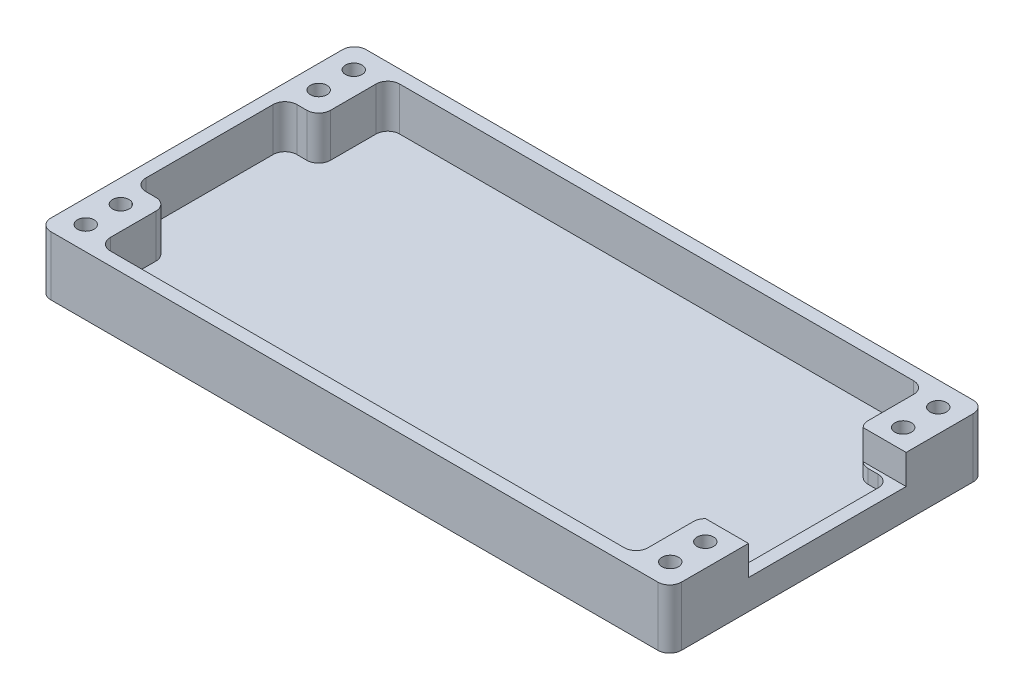
from build123d import *

# Parameters (mm, degrees)
EXTRUDE_1_DEPTH     = 15
CUT_EXTRUDE_1_DEPTH = 11
EXTRUDE_2_DEPTH     = 11
SKETCH_4_R          = 2.1
CUT_EXTRUDE_2_DEPTH = 91.691785736
FILLET_1_R          = 3
CUT_EXTRUDE_3_REACH = 167.605
SKETCH_5_W          = 40
SKETCH_5_H          = 40


with BuildPart() as part:
    # Эскиз1 → Бобышка-Вытянуть1 (new body)
    with BuildSketch(Plane(origin=(0, 0, 0), x_dir=(1, 0, 0), z_dir=(0, 1, 0))):
        with BuildLine():
            Line((-77, -40), (77, -40))
            ThreePointArc((77, -40), (79.121320344, -39.121320344), (80, -37))
            Line((80, -37), (80, 37))
            ThreePointArc((80, 37), (79.121320344, 39.121320344), (77, 40))
            Line((77, 40), (-77, 40))
            ThreePointArc((-77, 40), (-79.121320344, 39.121320344), (-80, 37))
            Line((-80, 37), (-80, -37))
            ThreePointArc((-80, -37), (-79.121320344, -39.121320344), (-77, -40))
        make_face()
    extrude(amount=EXTRUDE_1_DEPTH)

    # Эскиз2 → Вырез-Вытянуть1 (cut)
    with BuildSketch(Plane(origin=(0, 15, 0), x_dir=(1, 0, 0), z_dir=(0, 1, 0))):
        with BuildLine():
            Line((-75.75, -36.7), (75.75, -36.7))
            ThreePointArc((75.75, -36.7), (76.457106781, -36.407106781), (76.75, -35.7))
            Line((76.75, -35.7), (76.75, 35.7))
            ThreePointArc((76.75, 35.7), (76.457106781, 36.407106781), (75.75, 36.7))
            Line((75.75, 36.7), (-75.75, 36.7))
            ThreePointArc((-75.75, 36.7), (-76.457106781, 36.407106781), (-76.75, 35.7))
            Line((-76.75, 35.7), (-76.75, -35.7))
            ThreePointArc((-76.75, -35.7), (-76.457106781, -36.407106781), (-75.75, -36.7))
        make_face()
    extrude(amount=-CUT_EXTRUDE_1_DEPTH, mode=Mode.SUBTRACT)

    # Эскиз3 → Бобышка-Вытянуть2 (add)
    with BuildSketch(Plane(origin=(0, 4, 0), x_dir=(1, 0, 0), z_dir=(0, 1, 0))):
        with BuildLine():
            Line((-76.75, -36.7), (-68.2, -36.7))
            Line((-68.2, -36.7), (-68.2, -22.15))
            ThreePointArc((-68.2, -22.15), (-69.078679656, -20.028679656), (-71.2, -19.15))
            Line((-71.2, -19.15), (-76.75, -19.15))
            Line((-76.75, -19.15), (-76.75, -36.7))
        make_face()
        with BuildLine():
            Line((-68.2, 36.7), (-68.2, 22.15))
            ThreePointArc((-68.2, 22.15), (-69.078679656, 20.028679656), (-71.2, 19.15))
            Line((-71.2, 19.15), (-76.75, 19.15))
            Line((-76.75, 19.15), (-76.75, 36.7))
            Line((-76.75, 36.7), (-68.2, 36.7))
        make_face()
        with BuildLine():
            Line((76.75, 36.7), (68.2, 36.7))
            Line((68.2, 36.7), (68.2, 22.15))
            ThreePointArc((68.2, 22.15), (69.078679656, 20.028679656), (71.2, 19.15))
            Line((71.2, 19.15), (76.75, 19.15))
            Line((76.75, 19.15), (76.75, 36.7))
        make_face()
        with BuildLine():
            Line((68.2, -36.7), (68.2, -22.15))
            ThreePointArc((68.2, -22.15), (69.078679656, -20.028679656), (71.2, -19.15))
            Line((71.2, -19.15), (76.75, -19.15))
            Line((76.75, -19.15), (76.75, -36.7))
            Line((76.75, -36.7), (68.2, -36.7))
        make_face()
    extrude(amount=EXTRUDE_2_DEPTH)

    # Эскиз4 → Вырез-Вытянуть2 (cut, through all)
    with BuildSketch(Plane(origin=(0, 15, 0), x_dir=(1, 0, 0), z_dir=(0, 1, 0))):
        with Locations(Location((-74.15, -34, 0), (0, 0, 270))):
            Circle(SKETCH_4_R)
        with Locations(Location((-74.15, 34, 0), (0, 0, 90))):
            Circle(SKETCH_4_R)
        with Locations(Location((74.15, 34, 0), (0, 0, 270))):
            Circle(SKETCH_4_R)
        with Locations(Location((74.15, -34, 0), (0, 0, 90))):
            Circle(SKETCH_4_R)
        with Locations(Location((-74.15, -25.1, 0), (0, 0, 270))):
            Circle(SKETCH_4_R)
        with Locations(Location((-74.15, 25.1, 0), (0, 0, 90))):
            Circle(SKETCH_4_R)
        with Locations(Location((74.15, 25.1, 0), (0, 0, 270))):
            Circle(SKETCH_4_R)
        with Locations(Location((74.15, -25.1, 0), (0, 0, 90))):
            Circle(SKETCH_4_R)
    extrude(amount=-CUT_EXTRUDE_2_DEPTH, mode=Mode.SUBTRACT)

    # Скругление1
    fillet_1_edges = [part.edges().sort_by_distance(p)[0] for p in [
        (76.75, 9.5, 19.15),
        (68.2, 9.5, 36.7),
        (-68.2, 9.5, 36.7),
        (-76.75, 9.5, 19.15),
        (-76.75, 9.5, -19.15),
        (-68.2, 9.5, -36.7),
        (68.2, 9.5, -36.7),
        (76.75, 9.5, -19.15),
    ]]
    fillet(fillet_1_edges, radius=FILLET_1_R)

    # Вырез-Вытянуть3: up to this face of the body (flat: up to its plane)
    cut_extrude_3_end = Plane(part.part.faces().sort_by_distance((68.2, 9.5, -27.925))[0])
    # Эскиз5 → Вырез-Вытянуть3 (cut, up to the picked face)
    with BuildSketch(Plane(origin=(80, 0, 0), x_dir=(0, 0, -1), z_dir=(1, 0, 0)), mode=Mode.PRIVATE) as cut_extrude_3_sk1:
        with Locations((0, 27.5)):
            Rectangle(SKETCH_5_W, SKETCH_5_H)
    cut_extrude_3_tool1 = split(extrude(cut_extrude_3_sk1.sketch, amount=-CUT_EXTRUDE_3_REACH, mode=Mode.PRIVATE), bisect_by=cut_extrude_3_end, keep=Keep.BOTH, mode=Mode.PRIVATE)
    add(cut_extrude_3_tool1.solids().sort_by(Axis((80, 27.5, 0), (-1, 0, 0)))[0], mode=Mode.SUBTRACT)


solid = part.part
